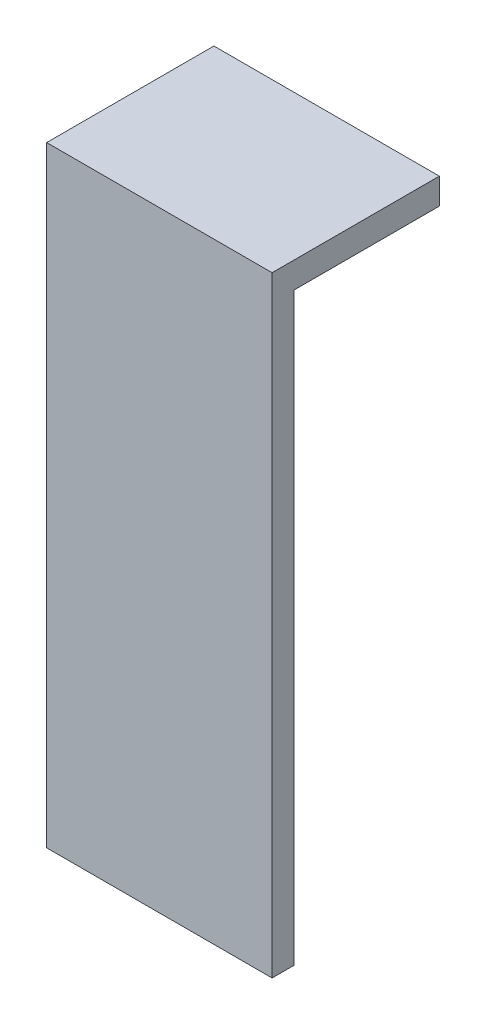
from build123d import *

# Parameters (mm, degrees)
SKETCH1_W           = 7.874
SKETCH1_H           = 0.762
BOSS_EXTRUDE1_DEPTH = 21.336
SKETCH2_W           = 7.874
SKETCH2_H           = 0.908244578
BOSS_EXTRUDE2_DEPTH = 5.08


with BuildPart() as part:
    # Sketch1 → Boss-Extrude1 (new body)
    with BuildSketch(Plane(origin=(0, 0, 0), x_dir=(1, 0, 0), z_dir=(0, 1, 0))):
        with Locations((-0.3175, 0.381)):
            Rectangle(SKETCH1_W, SKETCH1_H)
    extrude(amount=BOSS_EXTRUDE1_DEPTH)

    # Sketch2 → Boss-Extrude2 (add)
    with BuildSketch(Plane(origin=(0, 0, -0.762), x_dir=(-1, 0, 0), z_dir=(0, 0, -1))):
        with Locations((0.3175, 20.881877711)):
            Rectangle(SKETCH2_W, SKETCH2_H)
    extrude(amount=BOSS_EXTRUDE2_DEPTH)


solid = part.part
